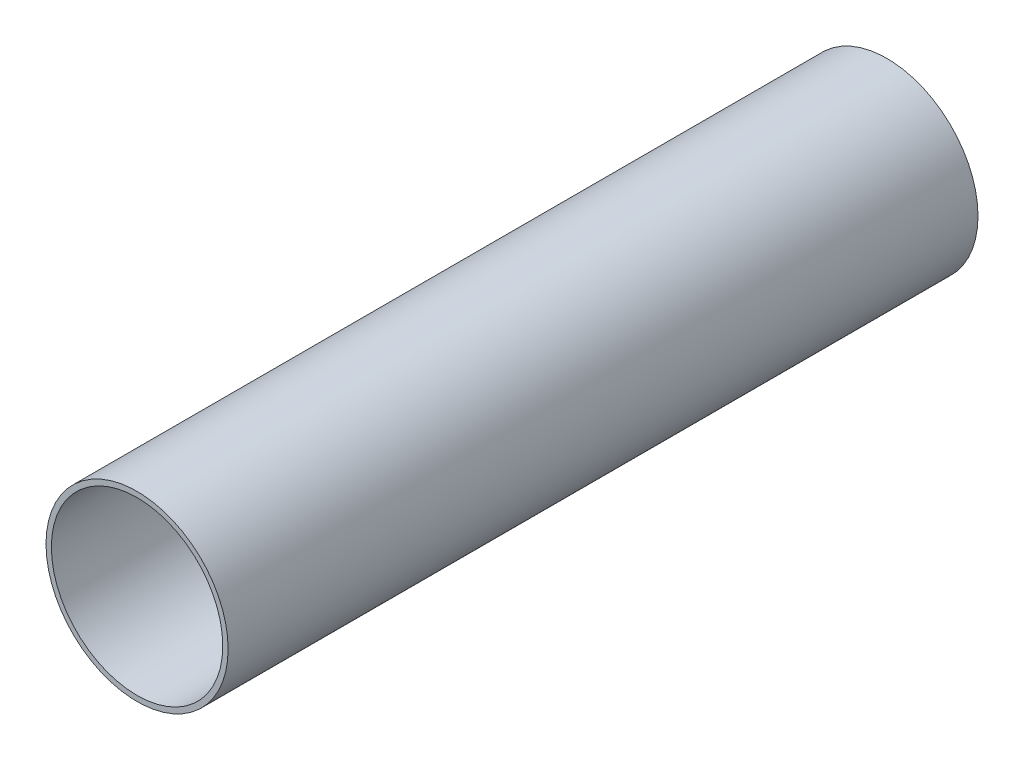
from build123d import *

# Parameters (mm, degrees)
SKETCH1_R           = 25.5
SKETCH1_R_2         = 24
BOSS_EXTRUDE1_DEPTH = 210


with BuildPart() as part:
    # Sketch1 → Boss-Extrude1 (new body)
    with BuildSketch(Plane.XY):
        Circle(SKETCH1_R)
        Circle(SKETCH1_R_2, mode=Mode.SUBTRACT)
    extrude(amount=BOSS_EXTRUDE1_DEPTH)


solid = part.part
